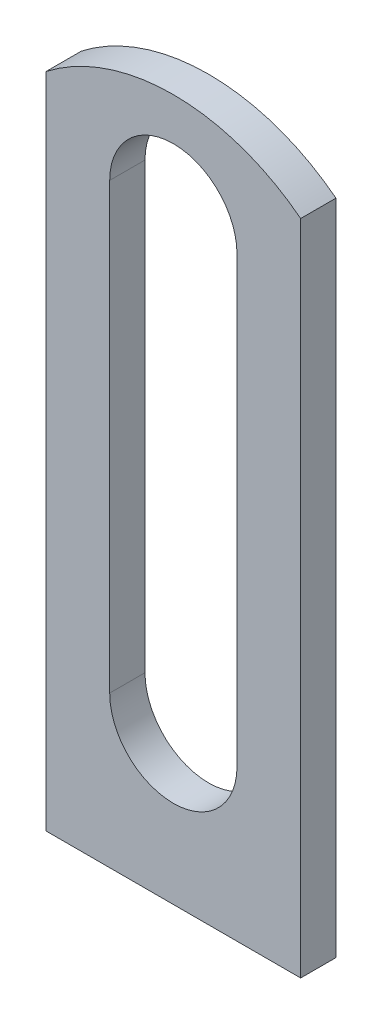
from build123d import *

# Parameters (mm, degrees)
BOSS_EXTRUDE1_DEPTH = 2.8


with BuildPart() as part:
    # Sketch1 → Boss-Extrude1 (new body)
    with BuildSketch(Plane.XY.offset(2.8)):
        with BuildLine():
            Line((0, 52.179630025), (0, 0))
            Line((0, 0), (20.2, 0))
            Line((20.2, 0), (20.2, 52.179630025))
            ThreePointArc((20.2, 52.179630025), (10.1, 55.643160629), (0, 52.179630025))
        make_face()
        with BuildLine():
            Line((15.15, 47.222342094), (15.15, 12))
            ThreePointArc((15.15, 12), (10.1, 6.95), (5.05, 12))
            Line((5.05, 12), (5.05, 47.222342094))
            ThreePointArc((5.05, 47.222342094), (10.1, 52.272342094), (15.15, 47.222342094))
        make_face(mode=Mode.SUBTRACT)
    extrude(amount=-BOSS_EXTRUDE1_DEPTH)


solid = part.part
